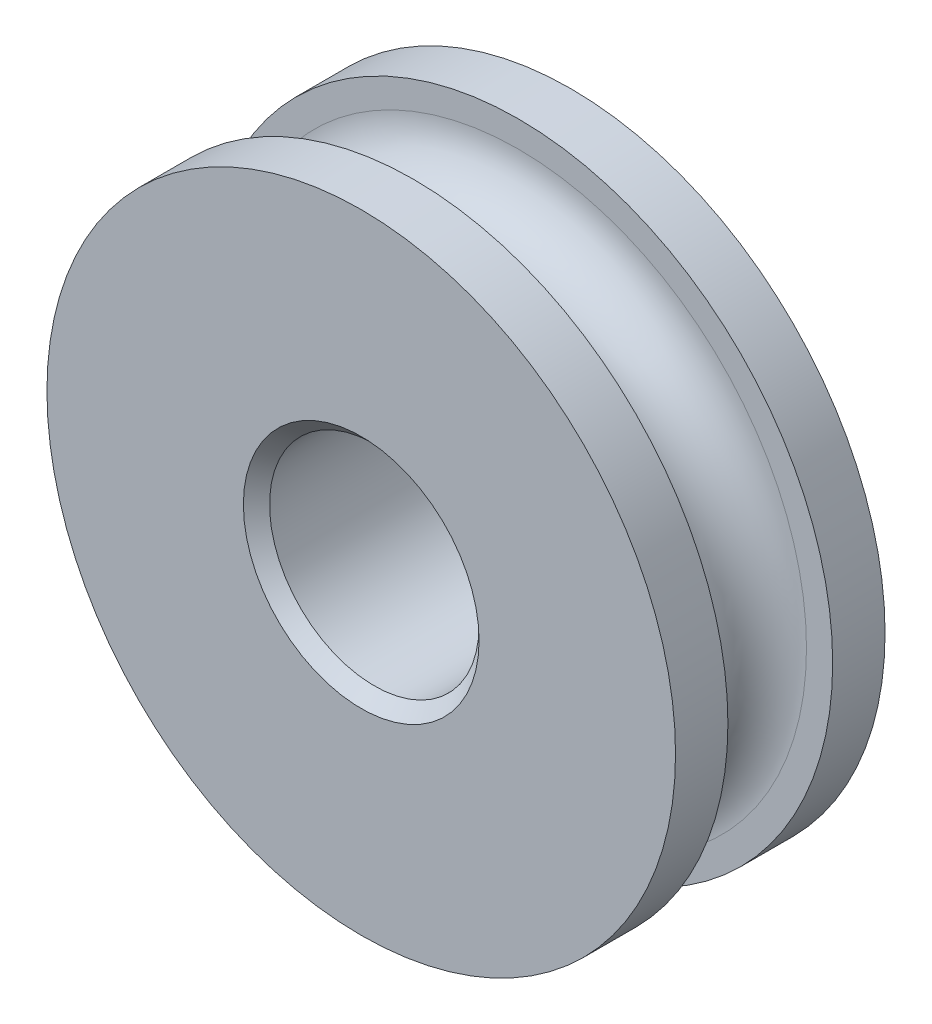
from build123d import *

# Parameters (mm, degrees)
SKETCH1_R      = 19.05
SKETCH1_R_2    = 6.35
EXTRUDE1_DEPTH = 6.35
CHAMFER1_SIZE  = 0.79375


with BuildPart() as part:
    # Sketch1 → Extrude1 (new, symmetric)
    with BuildSketch(Plane.XY):
        Circle(SKETCH1_R)
        Circle(SKETCH1_R_2, mode=Mode.SUBTRACT)
    extrude(amount=EXTRUDE1_DEPTH, both=True)

    # Chamfer1
    chamfer1_edges = [part.edges().sort_by_distance(p)[0] for p in [
        (-6.35, 0, -6.35),
        (-6.35, 0, 6.35),
    ]]
    chamfer(chamfer1_edges, length=CHAMFER1_SIZE)

    # Sketch2 → Cut-Revolve1 (revolve, cut)
    with BuildSketch(Plane(origin=(0, 0, 0), x_dir=(0, 0, -1), z_dir=(1, 0, 0)), mode=Mode.PRIVATE) as cut_revolve1_sk:
        with BuildLine():
            Line((-3.175, 17.4625), (-3.175, 19.05))
            Line((-3.175, 19.05), (3.175, 19.05))
            Line((3.175, 19.05), (3.175, 17.4625))
            ThreePointArc((3.175, 17.4625), (0, 14.2875), (-3.175, 17.4625))
        make_face()
    revolve(cut_revolve1_sk.sketch.rotate(Axis((0, 0, 6.35), (0, 0, -1)), 180), axis=Axis((0, 0, 6.35), (0, 0, -1)), mode=Mode.SUBTRACT)


solid = part.part
